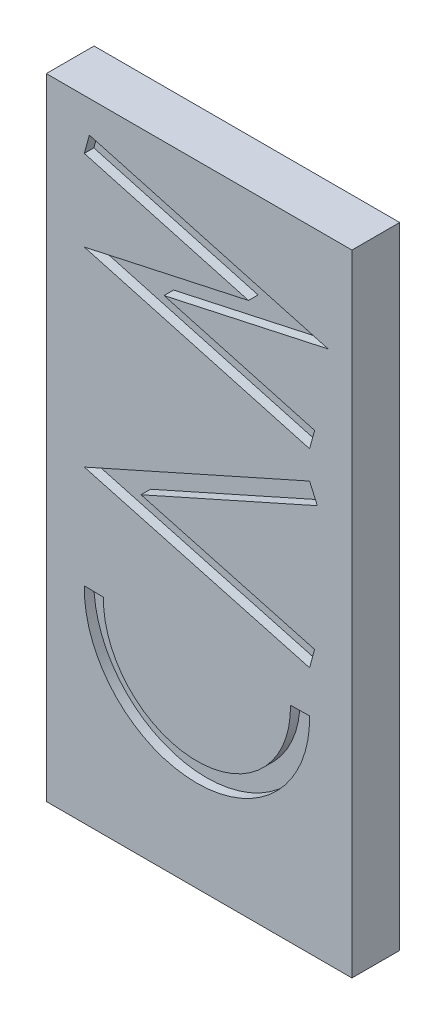
from build123d import *

# Parameters (mm, degrees)
ESQUISSE1_W             = 32
ESQUISSE1_H             = 66
BOSS_EXTRU_1_DEPTH      = 5
ENL_V_MAT_EXTRU_1_DEPTH = 1


with BuildPart() as part:
    # Esquisse1 → Boss.-Extru.1 (new body)
    with BuildSketch(Plane.XY):
        Rectangle(ESQUISSE1_W, ESQUISSE1_H)
    extrude(amount=BOSS_EXTRU_1_DEPTH)

    # Esquisse2 → Enlèv. mat.-Extru.1 (cut)
    with BuildSketch(Plane.XY.offset(5)):
        with BuildLine():
            Line((-10.020527486, -11.48471415), (-12.020211327, -11.449153833))
            ThreePointArc((-12.020211327, -11.449153833), (-0.228779166, -23.452136955), (11.562652994, -11.449153833))
            Line((11.562652994, -11.449153833), (9.562969153, -11.48471415))
            ThreePointArc((9.562969153, -11.48471415), (-0.228779166, -21.452136955), (-10.020527486, -11.48471415))
        make_face()
        Polygon((11.562652994, -7.092154157), (-12.020211327, -0.686337499), (11.562652994, 9.837504153), (12.377681975, 8.011106671), (-6.082483824, -0.226733274), (12.086916587, -5.162089991), align=None)
        Polygon((11.562652994, 12.765877482), (-12.020211327, 19.263205806), (5.170409159, 23.015184134), (-12.020211327, 27.751381734), (-11.488983181, 29.679540611), (13.517651309, 22.78994856), (-3.672969177, 19.037970232), (12.09388114, 14.694036359), align=None)
    extrude(amount=-ENL_V_MAT_EXTRU_1_DEPTH, mode=Mode.SUBTRACT)


solid = part.part
